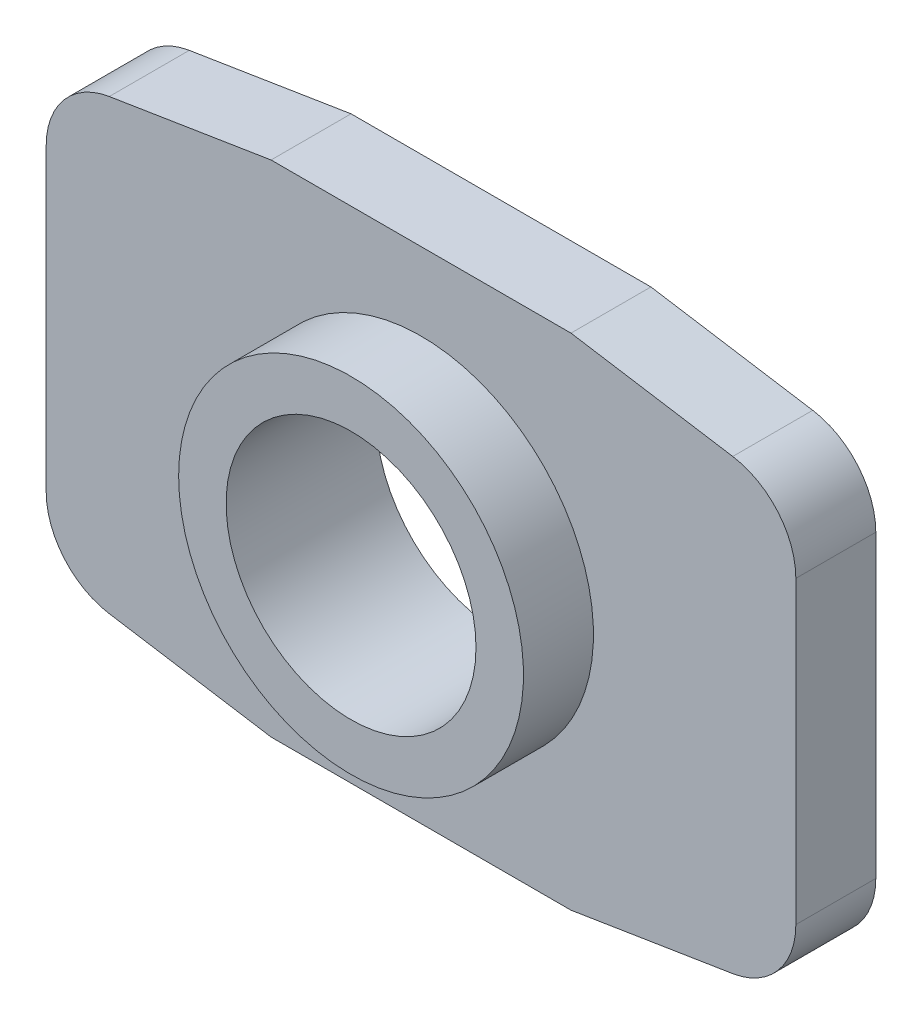
from build123d import *

# Parameters (mm, degrees)
BOSS_EXTRUDE1_DEPTH   = 1.6
SKETCH2_R             = 3.45
BOSS_EXTRUDE2_DEPTH   = 1.4
M6X1_0_TAPPED_HOLE1_D = 5


with BuildPart() as part:
    # Sketch1 → Boss-Extrude1 (new body)
    with BuildSketch(Plane.XY):
        with BuildLine():
            Line((-6.237396753, 4.481095129), (-3, 5))
            Line((-3, 5), (3, 5))
            Line((3, 5), (6.237396753, 4.481095129))
            ThreePointArc((6.237396753, 4.481095129), (7.141511088, 3.973114811), (7.5, 3))
            Line((7.5, 3), (7.5, -3))
            ThreePointArc((7.5, -3), (7.141511088, -3.973114811), (6.237396753, -4.481095129))
            Line((6.237396753, -4.481095129), (3, -5))
            Line((3, -5), (-3, -5))
            Line((-3, -5), (-6.237396753, -4.481095129))
            ThreePointArc((-6.237396753, -4.481095129), (-7.141511088, -3.973114811), (-7.5, -3))
            Line((-7.5, -3), (-7.5, 3))
            ThreePointArc((-7.5, 3), (-7.141511088, 3.973114811), (-6.237396753, 4.481095129))
        make_face()
    extrude(amount=BOSS_EXTRUDE1_DEPTH)

    # Sketch2 → Boss-Extrude2 (add)
    with BuildSketch(Plane.XY.offset(1.6)):
        Circle(SKETCH2_R)
    extrude(amount=BOSS_EXTRUDE2_DEPTH)

    # M6x1.0 Tapped Hole1 (through all)
    with Locations(Plane.XY.offset(3)):
        with Locations((0, 0)):
            Hole(M6X1_0_TAPPED_HOLE1_D / 2)


solid = part.part
